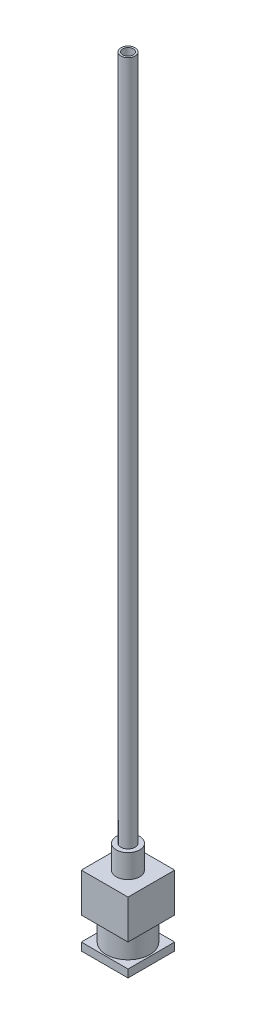
from build123d import *

# Parameters (mm, degrees)
SKETCH1_W               = 6
SKETCH1_H               = 6
BOSS_EXTRUDE1_DEPTH     = 9
SKETCH2_R               = 1.5
BOSS_EXTRUDE2_DEPTH     = 3
CUT_EXTRUDE1_DEPTH      = 13.727922061
CUT_EXTRUDE1_DEPTH_BACK = 13.727922061
SKETCH3_R               = 0.68
BOSS_EXTRUDE3_START     = 88
SKETCH3_3_R             = 0.92
SKETCH3_3_R_2           = 0.68
BOSS_EXTRUDE3_DEPTH     = 88
SKETCH4_R               = 2
CUT_EXTRUDE2_DEPTH      = 8
CUT_EXTRUDE3_START      = -1
SKETCH6_W               = 6
SKETCH6_H               = 6
SKETCH6_R               = 2.8
CUT_EXTRUDE3_DEPTH      = 3


with BuildPart() as part:
    # Sketch1 → Boss-Extrude1 (new body)
    with BuildSketch(Plane(origin=(0, 0, 0), x_dir=(1, 0, 0), z_dir=(0, 1, 0))):
        Rectangle(SKETCH1_W, SKETCH1_H)
    extrude(amount=BOSS_EXTRUDE1_DEPTH)

    # Sketch2 → Boss-Extrude2 (add)
    with BuildSketch(Plane(origin=(0, 9, 0), x_dir=(1, 0, 0), z_dir=(0, 1, 0))):
        with Locations(Location((0, 0, 0), (0, 0, 270))):
            Circle(SKETCH2_R)
    extrude(amount=BOSS_EXTRUDE2_DEPTH)

    # Sketch3 → Cut-Extrude1 (cut, two sides: drawn at the far end of the back side and taken through both)
    with BuildSketch(Plane(origin=(0, 12, 0), x_dir=(1, 0, 0), z_dir=(0, 1, 0)).offset(-CUT_EXTRUDE1_DEPTH_BACK)):
        with Locations(Location((0, 0, 0), (0, 0, 270))):
            Circle(SKETCH3_R)
    extrude(amount=CUT_EXTRUDE1_DEPTH + CUT_EXTRUDE1_DEPTH_BACK, mode=Mode.SUBTRACT)

    # Sketch3<3> → Boss-Extrude3 (add)
    with BuildSketch(Plane(origin=(0, 12, 0), x_dir=(1, 0, 0), z_dir=(0, 1, 0)).offset(BOSS_EXTRUDE3_START)):
        with Locations(Location((0, 0, 0), (0, 0, 270))):
            Circle(SKETCH3_3_R)
        with Locations(Location((0, 0, 0), (0, 0, 270))):
            Circle(SKETCH3_3_R_2, mode=Mode.SUBTRACT)
    extrude(amount=-BOSS_EXTRUDE3_DEPTH)

    # Sketch4 → Cut-Extrude2 (cut)
    with BuildSketch(Plane.XZ):
        with Locations(Location((0, 0, 0), (0, 0, 270))):
            Circle(SKETCH4_R)
    extrude(amount=-CUT_EXTRUDE2_DEPTH, mode=Mode.SUBTRACT)

    # Sketch6 → Cut-Extrude3 (cut)
    with BuildSketch(Plane.XZ.offset(CUT_EXTRUDE3_START)):
        Rectangle(SKETCH6_W, SKETCH6_H)
        with Locations(Location((0, 0, 0), (0, 0, 270))):
            Circle(SKETCH6_R, mode=Mode.SUBTRACT)
    extrude(amount=-CUT_EXTRUDE3_DEPTH, mode=Mode.SUBTRACT)


solid = part.part
